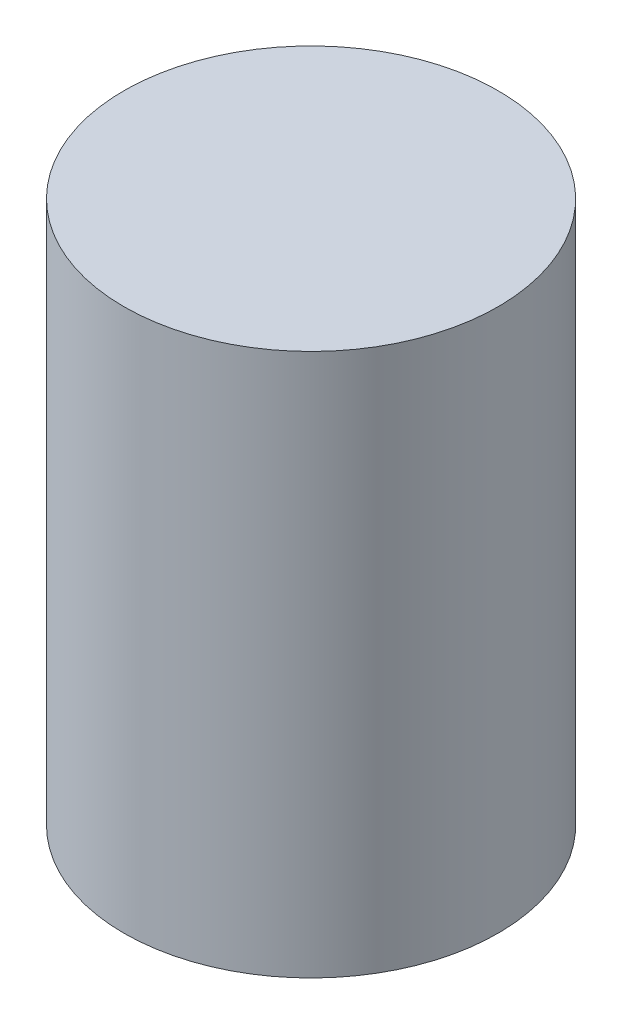
from build123d import *

# Parameters (mm, degrees)
SKETCH1_R           = 1
BOSS_EXTRUDE1_DEPTH = 2.9


with BuildPart() as part:
    # Sketch1 → Boss-Extrude1 (new body)
    with BuildSketch(Plane(origin=(0, 0, 0), x_dir=(1, 0, 0), z_dir=(0, 1, 0))):
        with Locations(Location((0, 0, 0), (0, 0, 270))):
            Circle(SKETCH1_R)
    extrude(amount=BOSS_EXTRUDE1_DEPTH)


solid = part.part
